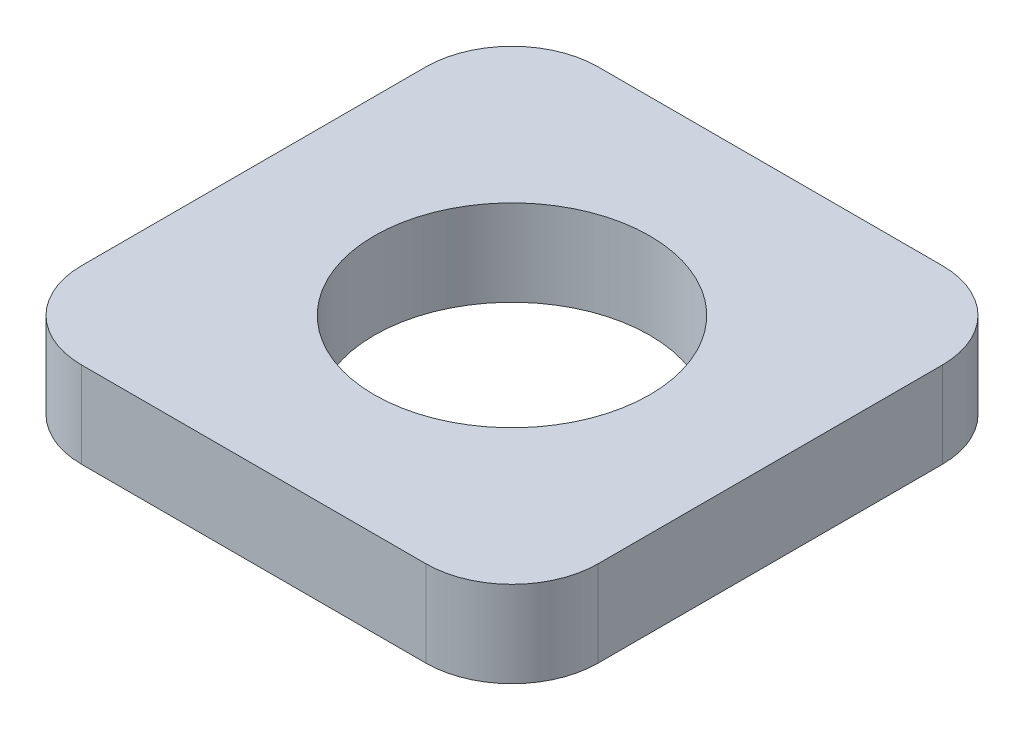
from build123d import *

# Parameters (mm, degrees)
ESBO_O1_R                = 1.6
RESSALTO_EXTRUS_O1_DEPTH = 1


with BuildPart() as part:
    # Esboço1 → Ressalto-extrusão1 (new body)
    with BuildSketch(Plane(origin=(0, 0, 0), x_dir=(1, 0, 0), z_dir=(0, 1, 0))):
        with BuildLine():
            Line((-2, -3), (2, -3))
            ThreePointArc((2, -3), (2.707106781, -2.707106781), (3, -2))
            Line((3, -2), (3, 2))
            ThreePointArc((3, 2), (2.707106781, 2.707106781), (2, 3))
            Line((2, 3), (-2, 3))
            ThreePointArc((-2, 3), (-2.707106781, 2.707106781), (-3, 2))
            Line((-3, 2), (-3, -2))
            ThreePointArc((-3, -2), (-2.707106781, -2.707106781), (-2, -3))
        make_face()
        with Locations(Location((0, 0, 0), (0, 0, 270))):
            Circle(ESBO_O1_R, mode=Mode.SUBTRACT)
    extrude(amount=RESSALTO_EXTRUS_O1_DEPTH)


solid = part.part
